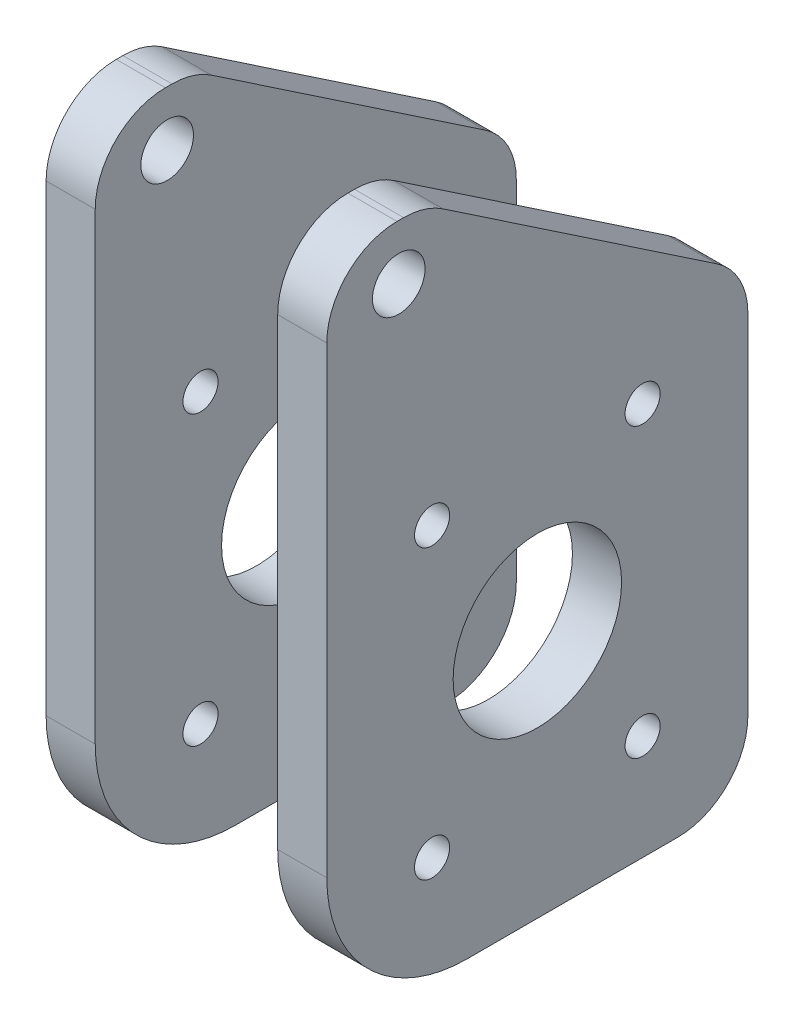
from build123d import *

# Parameters (mm, degrees)
SKETCH3_R           = 4.7625
SKETCH3_R_2         = 3.175
SKETCH3_R_3         = 15.24
BOSS_EXTRUDE1_DEPTH = 25.4
FILLET1_R           = 12.7
FILLET2_R           = 25.4
SKETCH4_W           = 33.02
SKETCH4_H           = 97.684209569
CUT_EXTRUDE1_DEPTH  = 2387.766721866


with BuildPart() as part:
    # Sketch3 → Boss-Extrude1 (new, symmetric)
    with BuildSketch(Plane.ZY.offset(-2292.351712769)):
        Polygon((556.612878185, 408.837981043), (556.612878185, 530.757981043), (538.832878185, 530.757981043), (480.412878185, 491.387981043), (480.412878185, 408.837981043), align=None)
        with Locations((543.597128475, 520.821960169)):
            Circle(SKETCH3_R, mode=Mode.SUBTRACT)
        with Locations((537.562878185, 479.957981043)):
            Circle(SKETCH3_R_2, mode=Mode.SUBTRACT)
        with Locations((537.562878185, 427.887981043)):
            Circle(SKETCH3_R_2, mode=Mode.SUBTRACT)
        with Locations((499.462878185, 427.887981043)):
            Circle(SKETCH3_R_2, mode=Mode.SUBTRACT)
        with Locations((499.462878185, 479.957981043)):
            Circle(SKETCH3_R_2, mode=Mode.SUBTRACT)
        with Locations((518.512878185, 453.922981043)):
            Circle(SKETCH3_R_3, mode=Mode.SUBTRACT)
    extrude(amount=BOSS_EXTRUDE1_DEPTH, both=True)

    # Fillet1
    fillet1_edges = [part.edges().sort_by_distance(p)[0] for p in [
        (2292.351712769, 408.837981043, 480.412878185),
        (2292.351712769, 491.387981043, 480.412878185),
        (2292.351712769, 530.757981043, 538.832878185),
        (2292.351712769, 530.757981043, 556.612878185),
    ]]
    fillet(fillet1_edges, radius=FILLET1_R)

    # Fillet2
    fillet2_edges = [part.edges().sort_by_distance(p)[0] for p in [
        (2292.351712769, 408.837981043, 556.612878185),
    ]]
    fillet(fillet2_edges, radius=FILLET2_R)

    # Sketch4 → Cut-Extrude1 (cut, through all)
    with BuildSketch(Plane.XZ.offset(-408.837981043)):
        with Locations((2292.351712769, 527.672036027)):
            Rectangle(SKETCH4_W, SKETCH4_H)
    extrude(amount=-CUT_EXTRUDE1_DEPTH, mode=Mode.SUBTRACT)


with BuildPart() as cut_extrude1_piece_1:
    # of the separate pieces the step leaves, piece 1, a body of its own (cut_extrude1_pieces)
    add(part.part.solids().sort_by_distance((2308.861712769, 434.237981043, 556.612878185))[0])


with BuildPart() as cut_extrude1_piece_2:
    # of the separate pieces the step leaves, piece 2, a body of its own (cut_extrude1_pieces)
    add(part.part.solids().sort_by_distance((2266.951712769, 434.237981043, 556.612878185))[0])


solid = Compound([cut_extrude1_piece_1.part, cut_extrude1_piece_2.part])
